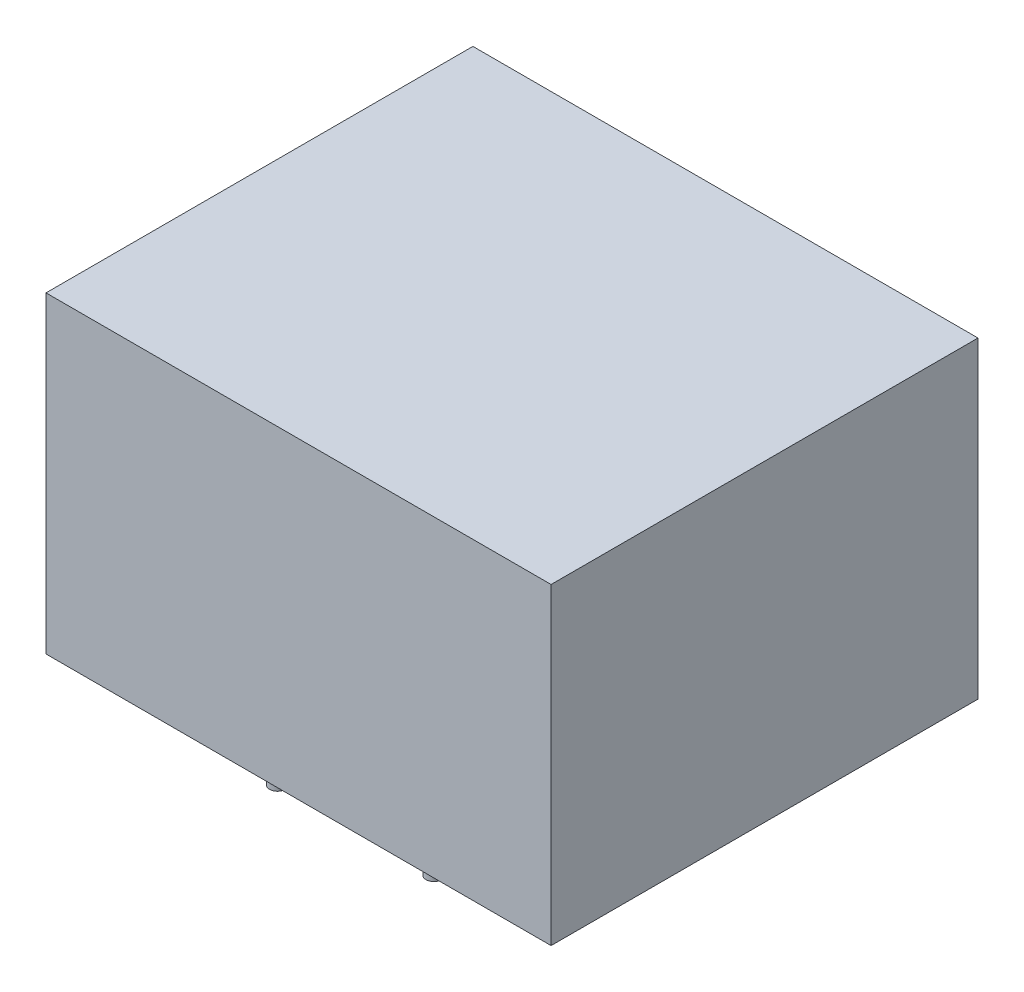
from build123d import *

# Parameters (mm, degrees)
SKETCH1_W            = 32.3
SKETCH1_H            = 27.3
BASE_EXTRUSION_DEPTH = 20
SKETCH2_R            = 0.5
PINS_DEPTH           = 3.5


with BuildPart() as part:
    # Sketch1 → Base Extrusion (new body)
    with BuildSketch(Plane(origin=(0, 0, 0), x_dir=(1, 0, 0), z_dir=(0, 1, 0))):
        Rectangle(SKETCH1_W, SKETCH1_H)
    extrude(amount=BASE_EXTRUSION_DEPTH)

    # Sketch2 → Pins (add)
    with BuildSketch(Plane.XZ):
        with Locations(Location((-5, 10, 0), (0, 0, 90))):
            Circle(SKETCH2_R)
        with Locations(Location((5, 10, 0), (0, 0, 90))):
            Circle(SKETCH2_R)
        with Locations(Location((-10, -10, 0), (0, 0, 90))):
            Circle(SKETCH2_R)
        with Locations(Location((10, -10, 0), (0, 0, 90))):
            Circle(SKETCH2_R)
    extrude(amount=PINS_DEPTH)


solid = part.part
